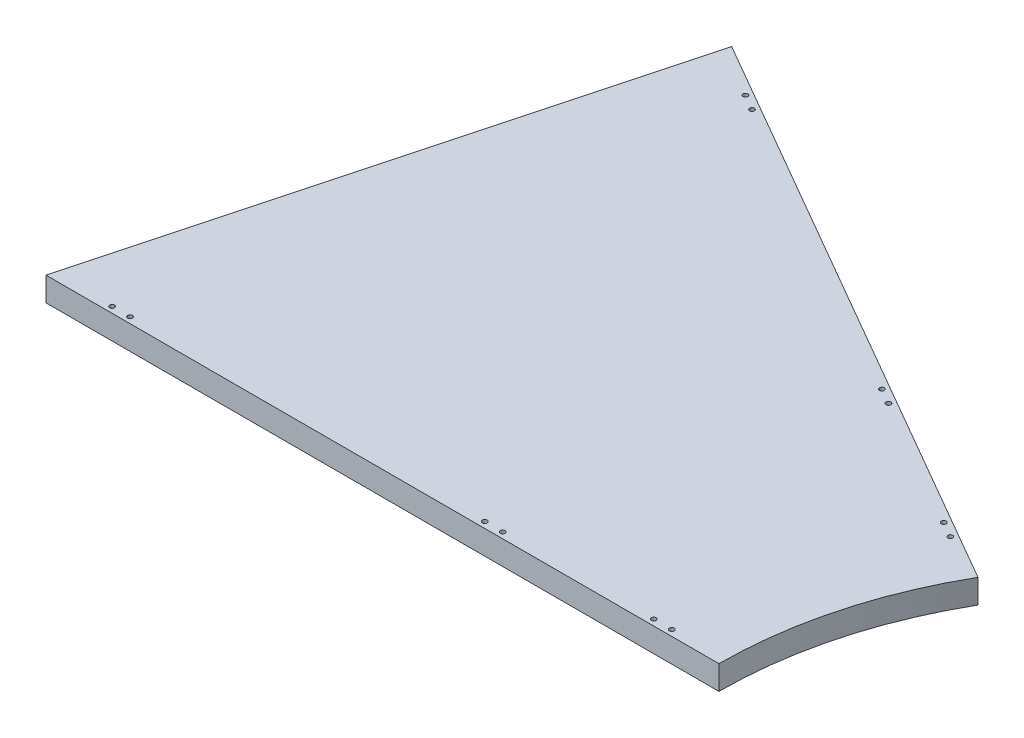
from build123d import *

# Parameters (mm, degrees)
BOSS_EXTRUDE1_DEPTH = 20
SKETCH2_R           = 2
CUT_EXTRUDE1_DEPTH  = 20


with BuildPart() as part:
    # Sketch1 → Boss-Extrude1 (new body)
    with BuildSketch(Plane(origin=(0, 0, 0), x_dir=(1, 0, 0), z_dir=(0, 1, 0))):
        with BuildLine():
            Line((-340, 0), (-900, 0))
            Line((-900, 0), (-779.422863406, 450))
            Line((-779.422863406, 450), (-294.448637287, 170))
            ThreePointArc((-294.448637287, 170), (-328.414780938, 87.998475335), (-340, 0))
        make_face()
    extrude(amount=BOSS_EXTRUDE1_DEPTH)

    # Sketch2 → Cut-Extrude1 (cut)
    with BuildSketch(Plane.XZ):
        with Locations(Location((-850, -5, 0), (0, 0, 270))):
            Circle(SKETCH2_R)
        with Locations(Location((-835, -5, 0), (0, 0, 270))):
            Circle(SKETCH2_R)
        with Locations(Location((-539.91, -5, 0), (0, 0, 270))):
            Circle(SKETCH2_R)
        with Locations(Location((-524.91, -5, 0), (0, 0, 270))):
            Circle(SKETCH2_R)
        with Locations(Location((-399.25, -5, 0), (0, 0, 270))):
            Circle(SKETCH2_R)
        with Locations(Location((-384.25, -5, 0), (0, 0, 270))):
            Circle(SKETCH2_R)
        with Locations(Location((-348.260642461, -195.294872981, 0), (0, 0, 90))):
            Circle(SKETCH2_R)
        with Locations(Location((-335.270261404, -187.794872981, 0), (0, 0, 90))):
            Circle(SKETCH2_R)
        with Locations(Location((-457.0853947, -258.124872981, 0), (0, 0, 90))):
            Circle(SKETCH2_R)
        with Locations(Location((-470.075775757, -265.624872981, 0), (0, 0, 90))):
            Circle(SKETCH2_R)
        with Locations(Location((-725.63121216, -413.169872981, 0), (0, 0, 90))):
            Circle(SKETCH2_R)
        with Locations(Location((-738.621593217, -420.669872981, 0), (0, 0, 90))):
            Circle(SKETCH2_R)
    extrude(amount=-CUT_EXTRUDE1_DEPTH, mode=Mode.SUBTRACT)


solid = part.part
